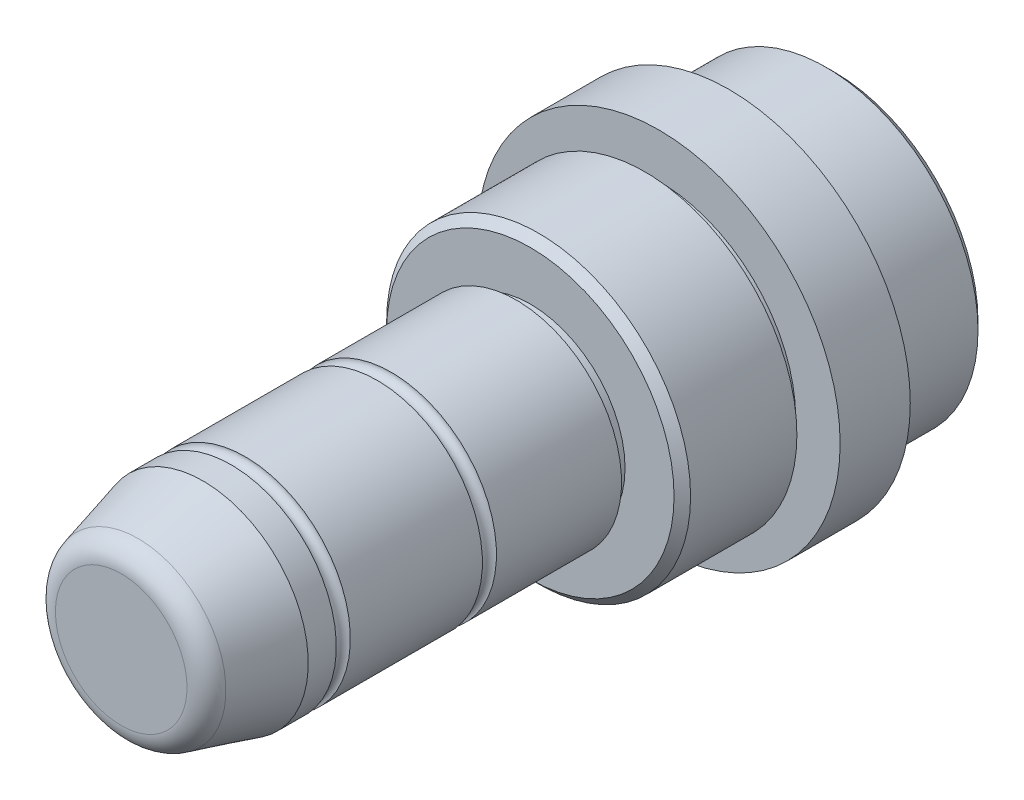
from build123d import *


with BuildPart() as part:
    # Эскиз1 → Повернуть1 (revolve)
    with BuildSketch(Plane.XZ, mode=Mode.PRIVATE) as revolve_1_sk:
        with BuildLine():
            Line((5.628068026, 61), (0, 61))
            Line((0, 61), (0, 0))
            Line((0, 0), (12.292893219, 0))
            Line((12.292893219, 0), (13, 0.707106781))
            Line((13, 0.707106781), (13, 7.8))
            Line((13, 7.8), (11.7, 7.8))
            Line((11.7, 7.8), (11.7, 9))
            Line((11.7, 9), (15.5, 9))
            Line((15.5, 9), (15.5, 15))
            Line((15.5, 15), (11.7, 15))
            Line((11.7, 15), (11.7, 16.2))
            Line((11.7, 16.2), (13, 16.2))
            Line((13, 16.2), (13, 25.292893219))
            Line((13, 25.292893219), (12.292893219, 26))
            Line((12.292893219, 26), (8.1, 26))
            Line((8.1, 26), (8.1, 27.2))
            Line((8.1, 27.2), (9, 27.2))
            Line((9, 27.2), (9, 37.8999999))
            ThreePointArc((9, 37.8999999), (8.4, 38.4999999), (9, 39.0999999))
            Line((9, 39.0999999), (9, 50.4))
            ThreePointArc((9, 50.4), (8.4, 51), (9, 51.6))
            Line((9, 51.6), (9, 54))
            Line((9, 54), (7.511623388, 59.554697138))
            ThreePointArc((7.511623388, 59.554697138), (6.815152813, 60.597039014), (5.628068026, 61))
        make_face()
    revolve(revolve_1_sk.sketch.rotate(Axis((0, 0, 61.005), (0, 0, -1)), 180), axis=Axis((0, 0, 61.005), (0, 0, -1)))


solid = part.part
